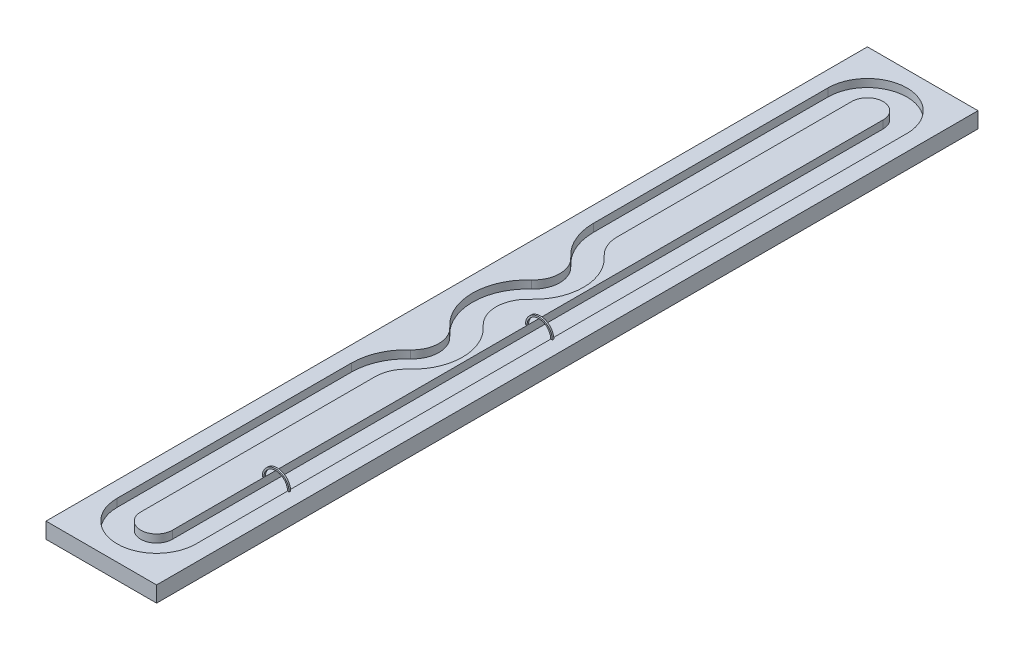
from build123d import *

# Parameters (mm, degrees)
SKETCH1_W           = 7000
SKETCH1_H           = 52000
BOSS_EXTRUDE1_DEPTH = 500
CUT_EXTRUDE1_DEPTH  = 500
BOSS_EXTRUDE2_DEPTH = 50
LPATTERN1_COUNT     = 2
LPATTERN1_PITCH     = 16660


with BuildPart() as part:
    # Sketch1 → Boss-Extrude1 (new, symmetric)
    with BuildSketch(Plane(origin=(0, 0, 0), x_dir=(1, 0, 0), z_dir=(0, 1, 0))):
        with Locations((0, 25000)):
            Rectangle(SKETCH1_W, SKETCH1_H)
    extrude(amount=BOSS_EXTRUDE1_DEPTH, both=True)

    # Sketch2 → Cut-Extrude1 (cut)
    with BuildSketch(Plane(origin=(0, 500, 0), x_dir=(1, 0, 0), z_dir=(0, 1, 0))):
        with BuildLine():
            Line((2500, 2500), (2500, 47500))
            ThreePointArc((2500, 47500), (0, 50000), (-2500, 47500))
            Line((-2500, 47500), (-2500, 32660))
            ThreePointArc((-2500, 32660), (-2200.151504292, 31244.31293804), (-1352.101905874, 30071.755537993))
            ThreePointArc((-1352.101905874, 30071.755537993), (-801.37772338, 28830), (-1352.101905874, 27588.244462007))
            ThreePointArc((-1352.101905874, 27588.244462007), (-2500, 25000), (-1352.101905874, 22411.755537993))
            ThreePointArc((-1352.101905874, 22411.755537993), (-801.37772338, 21170), (-1352.101905874, 19928.244462007))
            ThreePointArc((-1352.101905874, 19928.244462007), (-2200.151504292, 18755.68706196), (-2500, 17340))
            Line((-2500, 17340), (-2500, 2500))
            ThreePointArc((-2500, 2500), (0, 0), (2500, 2500))
        make_face()
        with BuildLine():
            Line((1000, 2500), (1000, 47500))
            ThreePointArc((1000, 47500), (0, 48500), (-1000, 47500))
            Line((-1000, 47500), (-1000, 32660))
            ThreePointArc((-1000, 32660), (-828.956274311, 31852.444207815), (-345.200094245, 31183.57779975))
            ThreePointArc((-345.200094245, 31183.57779975), (698.62227662, 28830), (-345.200094245, 26476.42220025))
            ThreePointArc((-345.200094245, 26476.42220025), (-1000, 25000), (-345.200094245, 23523.57779975))
            ThreePointArc((-345.200094245, 23523.57779975), (698.62227662, 21170), (-345.200094245, 18816.42220025))
            ThreePointArc((-345.200094245, 18816.42220025), (-828.956274311, 18147.555792185), (-1000, 17340))
            Line((-1000, 17340), (-1000, 2500))
            ThreePointArc((-1000, 2500), (0, 1500), (1000, 2500))
        make_face(mode=Mode.SUBTRACT)
    extrude(amount=-CUT_EXTRUDE1_DEPTH, mode=Mode.SUBTRACT)

    # Sketch3 → Boss-Extrude2 (add, symmetric)
    with BuildSketch(Plane(origin=(0, 0, -25000), x_dir=(-1, 0, 0), z_dir=(0, 0, -1))):
        with BuildLine():
            Line((-1000, 500), (-900, 500))
            ThreePointArc((-900, 500), (-1750, 1350), (-2600, 500))
            Line((-2600, 500), (-2500, 500))
            ThreePointArc((-2500, 500), (-1750, 1250), (-1000, 500))
        make_face()
    boss_extrude2 = extrude(amount=BOSS_EXTRUDE2_DEPTH, both=True)

    # LPattern1: Boss-Extrude2 ×2
    with Locations(*[(0, 0, i * LPATTERN1_PITCH) for i in range(1, LPATTERN1_COUNT)]):
        add(boss_extrude2)


solid = part.part
